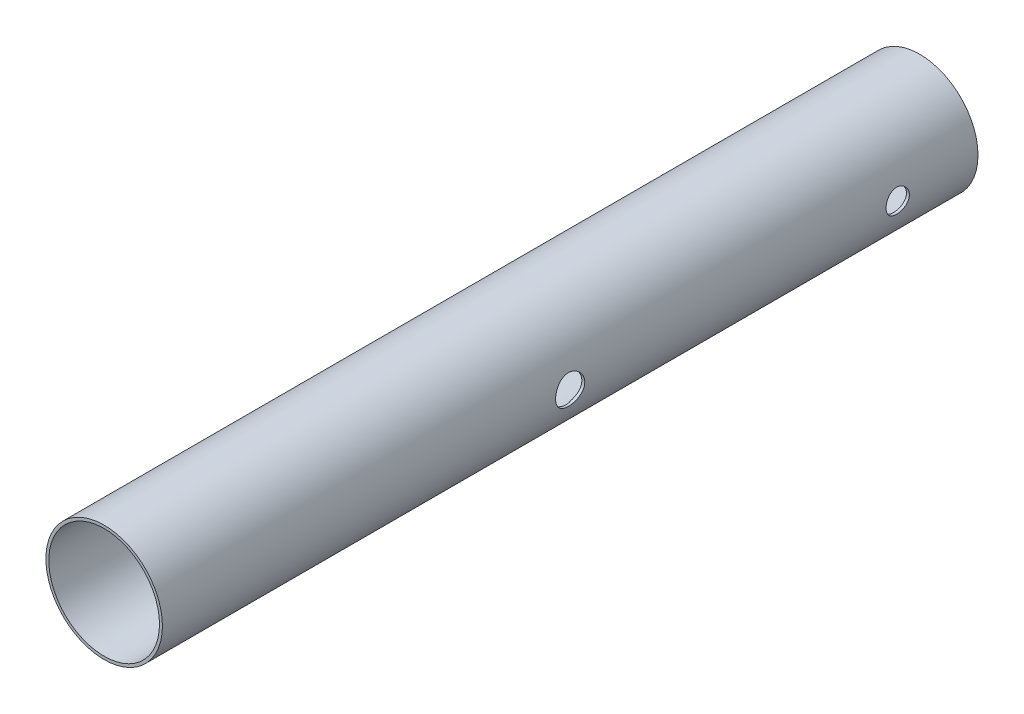
from build123d import *

# Parameters (mm, degrees)
ESBO_O2_R                  = 100
ESBO_O2_R_2                = 95
RESSALTO_EXTRUS_O2_DEPTH   = 1400
CORTE_EXTRUS_O1_DEPTH      = 1408.124727947
CORTE_EXTRUS_O1_DEPTH_BACK = 1408.124727947
ESBO_O3_R                  = 25
ESBO_O4_W                  = 14.042229064
ESBO_O4_H                  = 57.796016078
CORTE_EXTRUS_O2_DEPTH      = 92.5
ESBO_O5_R                  = 20
CORTE_EXTRUS_O3_DEPTH      = 185


with BuildPart() as part:
    # Esboço2 → Ressalto-extrusão2 (new body)
    with BuildSketch(Plane.XY):
        Circle(ESBO_O2_R)
        Circle(ESBO_O2_R_2, mode=Mode.SUBTRACT)
    extrude(amount=RESSALTO_EXTRUS_O2_DEPTH)

    # Esboço3 → Corte-extrusão1 (cut, two sides: drawn at the far end of the back side and taken through both)
    with BuildSketch(Plane(origin=(0, 0, 0), x_dir=(0, 0, -1), z_dir=(1, 0, 0)).offset(-CORTE_EXTRUS_O1_DEPTH_BACK)):
        with Locations((-700, 0)):
            Circle(ESBO_O3_R)
    extrude(amount=CORTE_EXTRUS_O1_DEPTH + CORTE_EXTRUS_O1_DEPTH_BACK, mode=Mode.SUBTRACT)

    # Esboço4 → Corte-extrusão2 (cut, symmetric)
    with BuildSketch(Plane(origin=(0, 0, 0), x_dir=(0, 0, -1), z_dir=(1, 0, 0))):
        with Locations((-700, 0)):
            Rectangle(ESBO_O4_W, ESBO_O4_H)
    extrude(amount=CORTE_EXTRUS_O2_DEPTH, both=True, mode=Mode.SUBTRACT)

    # Esboço5 → Corte-extrusão3 (cut)
    with BuildSketch(Plane(origin=(0, 0, 0), x_dir=(0, 0, -1), z_dir=(1, 0, 0))):
        with Locations(Location((-137.826137531, 0, 0), (0, 0, 180))):
            Circle(ESBO_O5_R)
    extrude(amount=CORTE_EXTRUS_O3_DEPTH, mode=Mode.SUBTRACT)


solid = part.part
